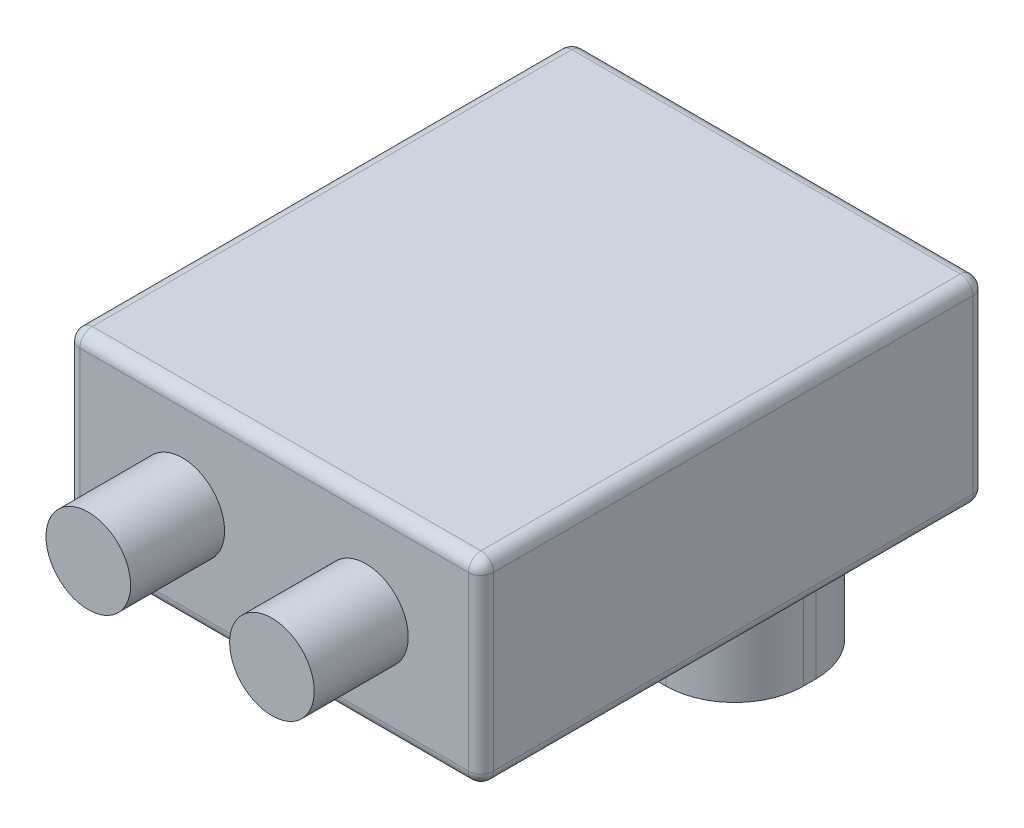
from build123d import *

# Parameters (mm, degrees)
SKETCH1_W           = 66
SKETCH1_H           = 80.5
BOSS_EXTRUDE1_DEPTH = 24.14
SKETCH2_W           = 50
SKETCH2_H           = 24
BOSS_EXTRUDE2_DEPTH = 19
SKETCH3_W           = 66
SKETCH3_H           = 80.5
BOSS_EXTRUDE3_DEPTH = 7.3
FILLET1_R           = 2
FILLET2_R           = 11
SKETCH4_R           = 6.75
BOSS_EXTRUDE4_DEPTH = 15


with BuildPart() as part:
    # Sketch1 → Boss-Extrude1 (new body)
    with BuildSketch(Plane(origin=(0, 0, 0), x_dir=(1, 0, 0), z_dir=(0, 1, 0))):
        Rectangle(SKETCH1_W, SKETCH1_H)
    extrude(amount=BOSS_EXTRUDE1_DEPTH)

    # Sketch2 → Boss-Extrude2 (add)
    with BuildSketch(Plane.XZ):
        with Locations((0, -20.25)):
            Rectangle(SKETCH2_W, SKETCH2_H)
    extrude(amount=BOSS_EXTRUDE2_DEPTH)

    # Sketch3 → Boss-Extrude3 (add)
    with BuildSketch(Plane(origin=(0, 24.14, 0), x_dir=(1, 0, 0), z_dir=(0, 1, 0))):
        Rectangle(SKETCH3_W, SKETCH3_H)
    extrude(amount=BOSS_EXTRUDE3_DEPTH)

    # Fillet1
    fillet1_edges = [part.edges().sort_by_distance(p)[0] for p in [
        (0, 31.44, 40.25),
        (33, 31.44, 0),
        (0, 31.44, -40.25),
        (-33, 31.44, 0),
        (0, 0, 40.25),
        (-33, 0, 0),
        (0, 0, -40.25),
        (33, 0, 0),
        (33, 15.72, 40.25),
        (-33, 15.72, 40.25),
        (-33, 15.72, -40.25),
        (33, 15.72, -40.25),
    ]]
    fillet(fillet1_edges, radius=FILLET1_R)

    # Fillet2
    fillet2_edges = [part.edges().sort_by_distance(p)[0] for p in [
        (-25, -9.5, -8.25),
        (-25, -9.5, -32.25),
        (25, -9.5, -32.25),
        (25, -9.5, -8.25),
    ]]
    fillet(fillet2_edges, radius=FILLET2_R)

    # Sketch4 → Boss-Extrude4 (add)
    with BuildSketch(Plane.XY.offset(40.25)):
        with Locations(Location((-14.64999991, 15.7200005, 0), (0, 0, 180))):
            Circle(SKETCH4_R)
        with Locations(Location((14.64999991, 15.7200005, 0), (0, 0, 180))):
            Circle(SKETCH4_R)
    extrude(amount=BOSS_EXTRUDE4_DEPTH)


solid = part.part
